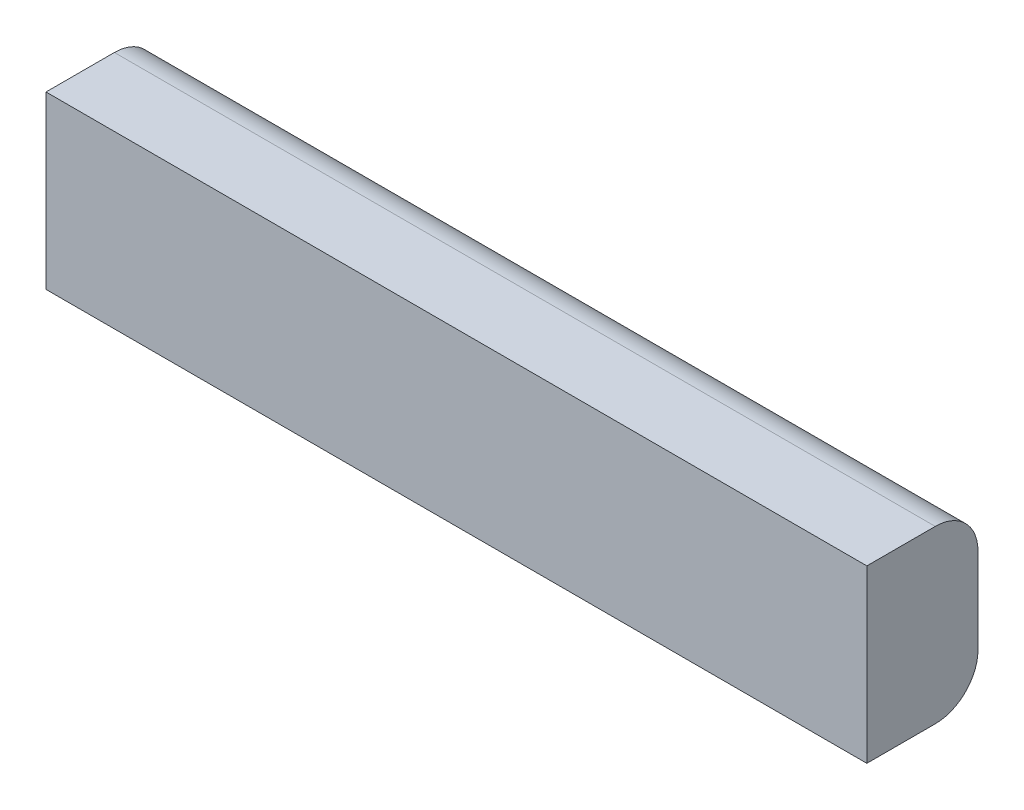
from build123d import *

# Parameters (mm, degrees)
BOSS_EXTRUDE1_DEPTH = 304.8


with BuildPart() as part:
    # Sketch1 → Boss-Extrude1 (new, symmetric)
    with BuildSketch(Plane(origin=(0, 0, 0), x_dir=(0, 0, -1), z_dir=(1, 0, 0))):
        with BuildLine():
            Line((49.373646209, 66.02166065), (-1.426353791, 66.02166065))
            Line((-1.426353791, 66.02166065), (-1.426353791, -60.97833935))
            Line((-1.426353791, -60.97833935), (49.373646209, -60.97833935))
            ThreePointArc((49.373646209, -60.97833935), (71.824286512, -51.678979653), (81.123646209, -29.22833935))
            Line((81.123646209, -29.22833935), (81.123646209, 34.27166065))
            ThreePointArc((81.123646209, 34.27166065), (71.824286512, 56.722300952), (49.373646209, 66.02166065))
        make_face()
    extrude(amount=BOSS_EXTRUDE1_DEPTH, both=True)


solid = part.part
